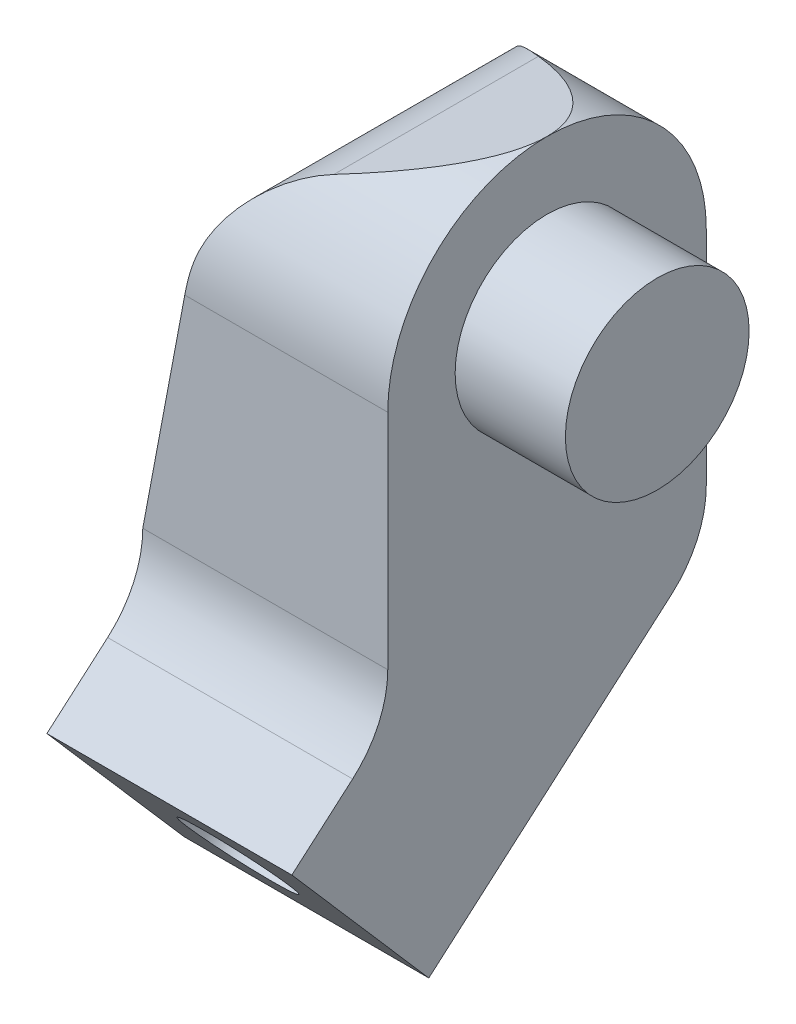
from build123d import *

# Parameters (mm, degrees)
SALIENTE_EXTRUIR1_DEPTH    = 6
CORTAR_EXTRUIR1_DEPTH      = 21.199491327
CORTAR_EXTRUIR1_DEPTH_BACK = 21.199491327
CROQUIS5_R                 = 4.5
SALIENTE_EXTRUIR2_DEPTH    = 5.4
CORTAR_EXTRUIR2_DEPTH      = 35.236779555
CORTAR_EXTRUIR2_DEPTH_BACK = 5.4
CROQUIS6_R                 = 2.5


with BuildPart() as part:
    # Croquis3 → Saliente-Extruir1 (new, symmetric)
    with BuildSketch(Plane(origin=(0, 0, 0), x_dir=(0, 0, -1), z_dir=(1, 0, 0))):
        with BuildLine():
            Line((10.148883832, 8.601817181), (10.148883832, -2.318345232))
            ThreePointArc((10.148883832, -2.318345232), (9.698275913, -4.392720245), (8.427671155, -6.093203335))
            Line((8.427671155, -6.093203335), (-3.440605337, -16.401817181))
            Line((-3.440605337, -16.401817181), (-10.148883832, -8.678596081))
            Line((-10.148883832, -8.678596081), (-7.172328845, -6.093203335))
            ThreePointArc((-7.172328845, -6.093203335), (-5.901724087, -4.392720245), (-5.451116168, -2.318345232))
            Line((-5.451116168, -2.318345232), (-5.451116168, 8.601817181))
            ThreePointArc((-5.451116168, 8.601817181), (2.348883832, 16.401817181), (10.148883832, 8.601817181))
        make_face()
    extrude(amount=SALIENTE_EXTRUIR1_DEPTH, both=True)

    # Croquis4 → Cortar-Extruir1 (cut, two sides: drawn at the far end of the back side and taken through both)
    with BuildSketch(Plane.XY.offset(-CORTAR_EXTRUIR1_DEPTH_BACK)):
        with BuildLine():
            Line((6, 16.401817181), (-6, 16.401817181))
            Line((-6, 16.401817181), (-6, -2.318345232))
            Line((-6, -2.318345232), (-3.751873124, 9.621314017))
            ThreePointArc((-3.751873124, 9.621314017), (-2.264862861, 12.688539179), (0.569888599, 14.581487642))
            Line((0.569888599, 14.581487642), (6, 16.401817181))
        make_face()
    extrude(amount=CORTAR_EXTRUIR1_DEPTH + CORTAR_EXTRUIR1_DEPTH_BACK, mode=Mode.SUBTRACT)

    # Croquis5 → Saliente-Extruir2 (add)
    with BuildSketch(Plane(origin=(6, 0, 0), x_dir=(0, 0, -1), z_dir=(1, 0, 0))):
        with Locations(Location((2.348883832, 8.601817181, 0), (0, 0, 180))):
            Circle(CROQUIS5_R)
    extrude(amount=SALIENTE_EXTRUIR2_DEPTH)

    # Croquis6 → Cortar-Extruir2 (cut, two sides: drawn at the far end of the back side and taken through both)
    with BuildSketch(Plane(origin=(0, -8.756443154, 10.081266986), x_dir=(1, 0, 0), z_dir=(0, -0.6557574645123035, 0.7549716204841048)).offset(-CORTAR_EXTRUIR2_DEPTH_BACK)):
        with Locations(Location((0, -5.016887417, 0), (0, 0, 90))):
            Circle(CROQUIS6_R)
    extrude(amount=CORTAR_EXTRUIR2_DEPTH + CORTAR_EXTRUIR2_DEPTH_BACK, mode=Mode.SUBTRACT)


solid = part.part
